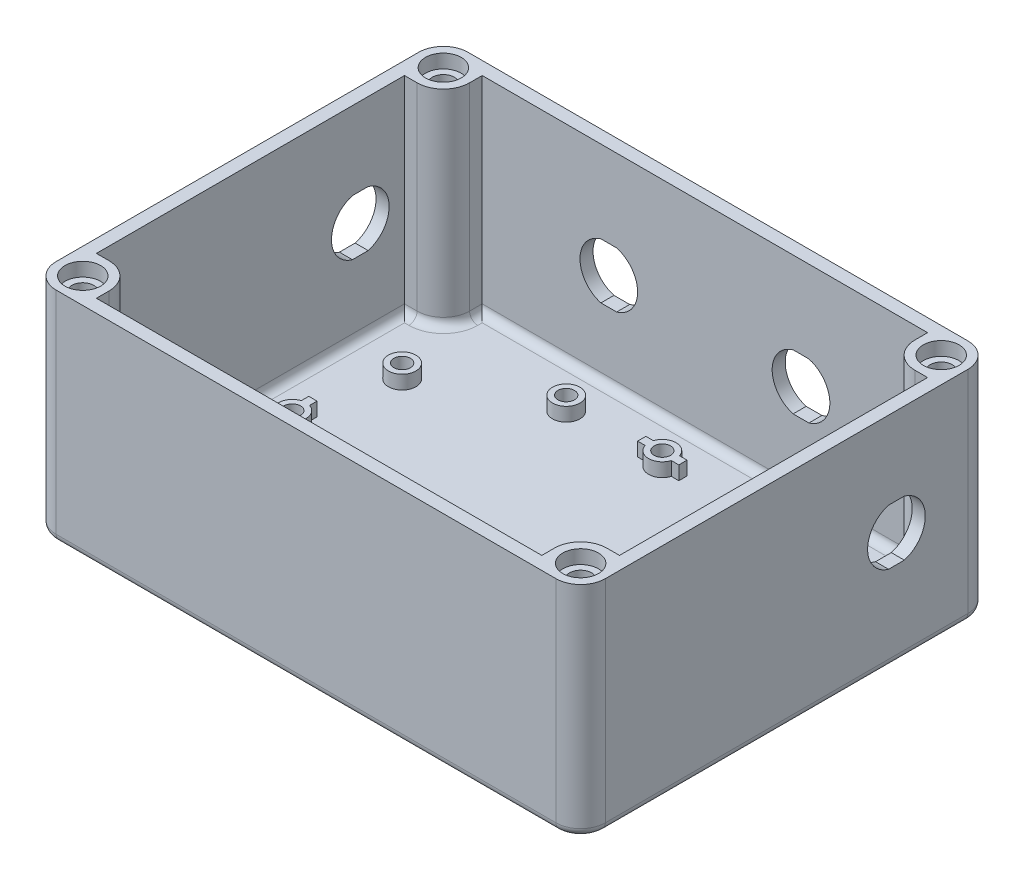
from build123d import *

# Parameters (mm, degrees)
SKETCH1_W           = 200
SKETCH1_H           = 150
BOSS_EXTRUDE1_DEPTH = 5
SKETCH2_W           = 200
SKETCH2_H           = 150
SKETCH2_W_2         = 190.5
SKETCH2_H_2         = 140.5
SKETCH2_R           = 4
BOSS_EXTRUDE2_DEPTH = 75
SKETCH3_R           = 6.5
CUT_EXTRUDE1_DEPTH  = 5
FILLET1_R           = 9
SKETCH4_R           = 5
SKETCH4_R_2         = 3
BOSS_EXTRUDE3_DEPTH = 5
FILLET2_R           = 3
FILLET3_R           = 3
CUT_EXTRUDE2_DEPTH  = 263.488094968
CUT_EXTRUDE3_DEPTH  = 10


with BuildPart() as part:
    # Sketch1 → Boss-Extrude1 (new body)
    with BuildSketch(Plane(origin=(0, 0, 0), x_dir=(1, 0, 0), z_dir=(0, 1, 0))):
        with Locations((100, 75)):
            Rectangle(SKETCH1_W, SKETCH1_H)
    extrude(amount=BOSS_EXTRUDE1_DEPTH)

    # Sketch2 → Boss-Extrude2 (add)
    # profile 1 of 5: a face of its own
    with BuildSketch(Plane(origin=(0, 5, 0), x_dir=(1, 0, 0), z_dir=(0, 1, 0))):
        with Locations((100, 75)):
            Rectangle(SKETCH2_W, SKETCH2_H)
        with Locations((100, 75)):
            Rectangle(SKETCH2_W_2, SKETCH2_H_2, mode=Mode.SUBTRACT)
    # profile 2 of 5: a face of its own
    with BuildSketch(Plane(origin=(0, 5, 0), x_dir=(1, 0, 0), z_dir=(0, 1, 0))):
        with BuildLine():
            Line((4.75, 145.25), (4.75, 131.1))
            Line((4.75, 131.1), (9.346194078, 131.1))
            ThreePointArc((9.346194078, 131.1), (16.101755032, 133.898244968), (18.9, 140.653805922))
            Line((18.9, 140.653805922), (18.9, 145.25))
            Line((18.9, 145.25), (4.75, 145.25))
        make_face()
        with Locations(Location((9.346194078, 140.653805922, 0), (0, 0, 90))):
            Circle(SKETCH2_R, mode=Mode.SUBTRACT)
    # profile 3 of 5: a face of its own
    with BuildSketch(Plane(origin=(0, 5, 0), x_dir=(1, 0, 0), z_dir=(0, 1, 0))):
        with BuildLine():
            Line((190.653805922, 131.1), (195.25, 131.1))
            Line((195.25, 131.1), (195.25, 145.25))
            Line((195.25, 145.25), (181.1, 145.25))
            Line((181.1, 145.25), (181.1, 140.653805922))
            ThreePointArc((181.1, 140.653805922), (183.898244968, 133.898244968), (190.653805922, 131.1))
        make_face()
        with Locations(Location((190.653805922, 140.653805922, 0), (0, 0, 270))):
            Circle(SKETCH2_R, mode=Mode.SUBTRACT)
    # profile 4 of 5: a face of its own
    with BuildSketch(Plane(origin=(0, 5, 0), x_dir=(1, 0, 0), z_dir=(0, 1, 0))):
        with BuildLine():
            Line((181.1, 9.346194078), (181.1, 4.75))
            Line((181.1, 4.75), (195.25, 4.75))
            Line((195.25, 4.75), (195.25, 18.9))
            Line((195.25, 18.9), (190.653805922, 18.9))
            ThreePointArc((190.653805922, 18.9), (183.898244968, 16.101755032), (181.1, 9.346194078))
        make_face()
        with Locations(Location((190.653805922, 9.346194078, 0), (0, 0, 90))):
            Circle(SKETCH2_R, mode=Mode.SUBTRACT)
    # profile 5 of 5: a face of its own
    with BuildSketch(Plane(origin=(0, 5, 0), x_dir=(1, 0, 0), z_dir=(0, 1, 0))):
        with BuildLine():
            Line((4.75, 18.9), (4.75, 4.75))
            Line((4.75, 4.75), (18.9, 4.75))
            Line((18.9, 4.75), (18.9, 9.346194078))
            ThreePointArc((18.9, 9.346194078), (16.101755032, 16.101755032), (9.346194078, 18.9))
            Line((9.346194078, 18.9), (4.75, 18.9))
        make_face()
        with Locations(Location((9.346194078, 9.346194078, 0), (0, 0, 270))):
            Circle(SKETCH2_R, mode=Mode.SUBTRACT)
    extrude(amount=BOSS_EXTRUDE2_DEPTH)

    # Sketch3 → Cut-Extrude1 (cut)
    with BuildSketch(Plane(origin=(0, 80, 0), x_dir=(1, 0, 0), z_dir=(0, 1, 0))):
        with Locations(Location((9.346194078, 140.653805922, 0), (0, 0, 270))):
            Circle(SKETCH3_R)
        with Locations(Location((190.653805922, 140.653805922, 0), (0, 0, 270))):
            Circle(SKETCH3_R)
        with Locations(Location((190.653805922, 9.346194078, 0), (0, 0, 270))):
            Circle(SKETCH3_R)
        with Locations(Location((9.346194078, 9.346194078, 0), (0, 0, 270))):
            Circle(SKETCH3_R)
    extrude(amount=-CUT_EXTRUDE1_DEPTH, mode=Mode.SUBTRACT)

    # Fillet1
    fillet1_edges = [part.edges().sort_by_distance(p)[0] for p in [
        (0, 40, -150),
        (200, 40, -150),
        (200, 40, 0),
        (0, 40, 0),
    ]]
    fillet(fillet1_edges, radius=FILLET1_R)

    # Sketch4 → Boss-Extrude3 (add)
    # profile 1 of 40: a face of its own
    with BuildSketch(Plane(origin=(0, 5, 0), x_dir=(1, 0, 0), z_dir=(0, 1, 0))):
        with Locations(Location((65, 129.75, 0), (0, 0, 90))):
            Circle(SKETCH4_R)
        with Locations(Location((65, 129.75, 0), (0, 0, 270))):
            Circle(SKETCH4_R_2, mode=Mode.SUBTRACT)
    # profile 2 of 40: a face of its own
    with BuildSketch(Plane(origin=(0, 5, 0), x_dir=(1, 0, 0), z_dir=(0, 1, 0))):
        with Locations(Location((25, 110, 0), (0, 0, 90))):
            Circle(SKETCH4_R)
        with Locations(Location((25, 110, 0), (0, 0, 270))):
            Circle(SKETCH4_R_2, mode=Mode.SUBTRACT)
    # profile 3 of 40: a face of its own
    with BuildSketch(Plane(origin=(0, 5, 0), x_dir=(1, 0, 0), z_dir=(0, 1, 0))):
        with BuildLine():
            Line((21.5, 82.5), (18.5, 82.5))
            Line((18.5, 82.5), (18.5, 79.769696007))
            ThreePointArc((18.5, 79.769696007), (20, 80), (21.5, 79.769696007))
            Line((21.5, 79.769696007), (21.5, 82.5))
        make_face()
    # profile 4 of 40: a face of its own
    with BuildSketch(Plane(origin=(0, 5, 0), x_dir=(1, 0, 0), z_dir=(0, 1, 0))):
        with BuildLine():
            ThreePointArc((21.5, 79.769696007), (20, 80), (18.5, 79.769696007))
            Line((18.5, 79.769696007), (18.5, 77.598076211))
            ThreePointArc((18.5, 77.598076211), (20, 78), (21.5, 77.598076211))
            Line((21.5, 77.598076211), (21.5, 79.769696007))
        make_face()
    # profile 5 of 40: a face of its own
    with BuildSketch(Plane(origin=(0, 5, 0), x_dir=(1, 0, 0), z_dir=(0, 1, 0))):
        with BuildLine():
            Line((18.5, 72.401923789), (18.5, 70.230303993))
            ThreePointArc((18.5, 70.230303993), (20, 70), (21.5, 70.230303993))
            Line((21.5, 70.230303993), (21.5, 72.401923789))
            ThreePointArc((21.5, 72.401923789), (20, 72), (18.5, 72.401923789))
        make_face()
    # profile 6 of 40: a face of its own
    with BuildSketch(Plane(origin=(0, 5, 0), x_dir=(1, 0, 0), z_dir=(0, 1, 0))):
        with BuildLine():
            Line((18.5, 77.598076211), (18.5, 79.769696007))
            ThreePointArc((18.5, 79.769696007), (15, 75), (18.5, 70.230303993))
            Line((18.5, 70.230303993), (18.5, 72.401923789))
            ThreePointArc((18.5, 72.401923789), (17, 75), (18.5, 77.598076211))
        make_face()
    # profile 7 of 40: a face of its own
    with BuildSketch(Plane(origin=(0, 5, 0), x_dir=(1, 0, 0), z_dir=(0, 1, 0))):
        with BuildLine():
            ThreePointArc((25, 75), (24.031128874, 77.958039892), (21.5, 79.769696007))
            Line((21.5, 79.769696007), (21.5, 77.598076211))
            ThreePointArc((21.5, 77.598076211), (22.598076211, 76.5), (23, 75))
            ThreePointArc((23, 75), (22.598076211, 73.5), (21.5, 72.401923789))
            Line((21.5, 72.401923789), (21.5, 70.230303993))
            ThreePointArc((21.5, 70.230303993), (24.031128874, 72.041960108), (25, 75))
        make_face()
    # profile 8 of 40: a face of its own
    with BuildSketch(Plane(origin=(0, 5, 0), x_dir=(1, 0, 0), z_dir=(0, 1, 0))):
        with BuildLine():
            ThreePointArc((21.5, 79.769696007), (20, 80), (18.5, 79.769696007))
            Line((18.5, 79.769696007), (18.5, 77.598076211))
            ThreePointArc((18.5, 77.598076211), (20, 78), (21.5, 77.598076211))
            Line((21.5, 77.598076211), (21.5, 79.769696007))
        make_face()
    # profile 9 of 40: a face of its own
    with BuildSketch(Plane(origin=(0, 5, 0), x_dir=(1, 0, 0), z_dir=(0, 1, 0))):
        with BuildLine():
            Line((18.5, 72.401923789), (18.5, 70.230303993))
            ThreePointArc((18.5, 70.230303993), (20, 70), (21.5, 70.230303993))
            Line((21.5, 70.230303993), (21.5, 72.401923789))
            ThreePointArc((21.5, 72.401923789), (20, 72), (18.5, 72.401923789))
        make_face()
    # profile 10 of 40: a face of its own
    with BuildSketch(Plane(origin=(0, 5, 0), x_dir=(1, 0, 0), z_dir=(0, 1, 0))):
        with BuildLine():
            ThreePointArc((21.5, 70.230303993), (20, 70), (18.5, 70.230303993))
            Line((18.5, 70.230303993), (18.5, 67.5))
            Line((18.5, 67.5), (21.5, 67.5))
            Line((21.5, 67.5), (21.5, 70.230303993))
        make_face()
    # profile 11 of 40: a face of its own
    with BuildSketch(Plane(origin=(0, 5, 0), x_dir=(1, 0, 0), z_dir=(0, 1, 0))):
        with Locations(Location((25, 40, 0), (0, 0, 90))):
            Circle(SKETCH4_R)
        with Locations(Location((25, 40, 0), (0, 0, 270))):
            Circle(SKETCH4_R_2, mode=Mode.SUBTRACT)
    # profile 12 of 40: a face of its own
    with BuildSketch(Plane(origin=(0, 5, 0), x_dir=(1, 0, 0), z_dir=(0, 1, 0))):
        with Locations(Location((65, 20.25, 0), (0, 0, 90))):
            Circle(SKETCH4_R)
        with Locations(Location((65, 20.25, 0), (0, 0, 270))):
            Circle(SKETCH4_R_2, mode=Mode.SUBTRACT)
    # profile 13 of 40: a face of its own
    with BuildSketch(Plane(origin=(0, 5, 0), x_dir=(1, 0, 0), z_dir=(0, 1, 0))):
        with BuildLine():
            ThreePointArc((104.769696007, 21.75), (100, 25.25), (95.230303993, 21.75))
            Line((95.230303993, 21.75), (97.401923789, 21.75))
            ThreePointArc((97.401923789, 21.75), (100, 23.25), (102.598076211, 21.75))
            Line((102.598076211, 21.75), (104.769696007, 21.75))
        make_face()
    # profile 14 of 40: a face of its own
    with BuildSketch(Plane(origin=(0, 5, 0), x_dir=(1, 0, 0), z_dir=(0, 1, 0))):
        with BuildLine():
            Line((97.401923789, 21.75), (95.230303993, 21.75))
            ThreePointArc((95.230303993, 21.75), (95, 20.25), (95.230303993, 18.75))
            Line((95.230303993, 18.75), (97.401923789, 18.75))
            ThreePointArc((97.401923789, 18.75), (97, 20.25), (97.401923789, 21.75))
        make_face()
    # profile 15 of 40: a face of its own
    with BuildSketch(Plane(origin=(0, 5, 0), x_dir=(1, 0, 0), z_dir=(0, 1, 0))):
        with BuildLine():
            ThreePointArc((105, 20.25), (104.942088629, 21.008788496), (104.769696007, 21.75))
            Line((104.769696007, 21.75), (102.598076211, 21.75))
            ThreePointArc((102.598076211, 21.75), (102.897777479, 21.026457135), (103, 20.25))
            ThreePointArc((103, 20.25), (102.897777479, 19.473542865), (102.598076211, 18.75))
            Line((102.598076211, 18.75), (104.769696007, 18.75))
            ThreePointArc((104.769696007, 18.75), (104.942088629, 19.491211504), (105, 20.25))
        make_face()
    # profile 16 of 40: a face of its own
    with BuildSketch(Plane(origin=(0, 5, 0), x_dir=(1, 0, 0), z_dir=(0, 1, 0))):
        with BuildLine():
            Line((95.230303993, 21.75), (92.5, 21.75))
            Line((92.5, 21.75), (92.5, 18.75))
            Line((92.5, 18.75), (95.230303993, 18.75))
            ThreePointArc((95.230303993, 18.75), (95, 20.25), (95.230303993, 21.75))
        make_face()
    # profile 17 of 40: a face of its own
    with BuildSketch(Plane(origin=(0, 5, 0), x_dir=(1, 0, 0), z_dir=(0, 1, 0))):
        with BuildLine():
            Line((97.401923789, 18.75), (95.230303993, 18.75))
            ThreePointArc((95.230303993, 18.75), (100, 15.25), (104.769696007, 18.75))
            Line((104.769696007, 18.75), (102.598076211, 18.75))
            ThreePointArc((102.598076211, 18.75), (100, 17.25), (97.401923789, 18.75))
        make_face()
    # profile 18 of 40: a face of its own
    with BuildSketch(Plane(origin=(0, 5, 0), x_dir=(1, 0, 0), z_dir=(0, 1, 0))):
        with BuildLine():
            Line((107.5, 21.75), (104.769696007, 21.75))
            ThreePointArc((104.769696007, 21.75), (104.942088629, 21.008788496), (105, 20.25))
            ThreePointArc((105, 20.25), (104.942088629, 19.491211504), (104.769696007, 18.75))
            Line((104.769696007, 18.75), (107.5, 18.75))
            Line((107.5, 18.75), (107.5, 21.75))
        make_face()
    # profile 19 of 40: a face of its own
    with BuildSketch(Plane(origin=(0, 5, 0), x_dir=(1, 0, 0), z_dir=(0, 1, 0))):
        with BuildLine():
            Line((97.401923789, 21.75), (95.230303993, 21.75))
            ThreePointArc((95.230303993, 21.75), (95, 20.25), (95.230303993, 18.75))
            Line((95.230303993, 18.75), (97.401923789, 18.75))
            ThreePointArc((97.401923789, 18.75), (97, 20.25), (97.401923789, 21.75))
        make_face()
    # profile 20 of 40: a face of its own
    with BuildSketch(Plane(origin=(0, 5, 0), x_dir=(1, 0, 0), z_dir=(0, 1, 0))):
        with BuildLine():
            ThreePointArc((105, 20.25), (104.942088629, 21.008788496), (104.769696007, 21.75))
            Line((104.769696007, 21.75), (102.598076211, 21.75))
            ThreePointArc((102.598076211, 21.75), (102.897777479, 21.026457135), (103, 20.25))
            ThreePointArc((103, 20.25), (102.897777479, 19.473542865), (102.598076211, 18.75))
            Line((102.598076211, 18.75), (104.769696007, 18.75))
            ThreePointArc((104.769696007, 18.75), (104.942088629, 19.491211504), (105, 20.25))
        make_face()
    # profile 21 of 40: a face of its own
    with BuildSketch(Plane(origin=(0, 5, 0), x_dir=(1, 0, 0), z_dir=(0, 1, 0))):
        with Locations(Location((135, 20.25, 0), (0, 0, 270))):
            Circle(SKETCH4_R)
        with Locations(Location((135, 20.25, 0), (0, 0, 90))):
            Circle(SKETCH4_R_2, mode=Mode.SUBTRACT)
    # profile 22 of 40: a face of its own
    with BuildSketch(Plane(origin=(0, 5, 0), x_dir=(1, 0, 0), z_dir=(0, 1, 0))):
        with Locations(Location((175, 40, 0), (0, 0, 270))):
            Circle(SKETCH4_R)
        with Locations(Location((175, 40, 0), (0, 0, 90))):
            Circle(SKETCH4_R_2, mode=Mode.SUBTRACT)
    # profile 23 of 40: a face of its own
    with BuildSketch(Plane(origin=(0, 5, 0), x_dir=(1, 0, 0), z_dir=(0, 1, 0))):
        with BuildLine():
            Line((178.5, 82.5), (178.5, 79.769696007))
            ThreePointArc((178.5, 79.769696007), (180, 80), (181.5, 79.769696007))
            Line((181.5, 79.769696007), (181.5, 82.5))
            Line((181.5, 82.5), (178.5, 82.5))
        make_face()
    # profile 24 of 40: a face of its own
    with BuildSketch(Plane(origin=(0, 5, 0), x_dir=(1, 0, 0), z_dir=(0, 1, 0))):
        with BuildLine():
            ThreePointArc((178.5, 79.769696007), (175, 75), (178.5, 70.230303993))
            Line((178.5, 70.230303993), (178.5, 72.401923789))
            ThreePointArc((178.5, 72.401923789), (177, 75), (178.5, 77.598076211))
            Line((178.5, 77.598076211), (178.5, 79.769696007))
        make_face()
    # profile 25 of 40: a face of its own
    with BuildSketch(Plane(origin=(0, 5, 0), x_dir=(1, 0, 0), z_dir=(0, 1, 0))):
        with BuildLine():
            ThreePointArc((178.5, 70.230303993), (180, 70), (181.5, 70.230303993))
            Line((181.5, 70.230303993), (181.5, 72.401923789))
            ThreePointArc((181.5, 72.401923789), (180, 72), (178.5, 72.401923789))
            Line((178.5, 72.401923789), (178.5, 70.230303993))
        make_face()
    # profile 26 of 40: a face of its own
    with BuildSketch(Plane(origin=(0, 5, 0), x_dir=(1, 0, 0), z_dir=(0, 1, 0))):
        with BuildLine():
            ThreePointArc((181.5, 79.769696007), (180, 80), (178.5, 79.769696007))
            Line((178.5, 79.769696007), (178.5, 77.598076211))
            ThreePointArc((178.5, 77.598076211), (180, 78), (181.5, 77.598076211))
            Line((181.5, 77.598076211), (181.5, 79.769696007))
        make_face()
    # profile 27 of 40: a face of its own
    with BuildSketch(Plane(origin=(0, 5, 0), x_dir=(1, 0, 0), z_dir=(0, 1, 0))):
        with BuildLine():
            Line((181.5, 72.401923789), (181.5, 70.230303993))
            ThreePointArc((181.5, 70.230303993), (184.031128874, 72.041960108), (185, 75))
            ThreePointArc((185, 75), (184.031128874, 77.958039892), (181.5, 79.769696007))
            Line((181.5, 79.769696007), (181.5, 77.598076211))
            ThreePointArc((181.5, 77.598076211), (182.598076211, 76.5), (183, 75))
            ThreePointArc((183, 75), (182.598076211, 73.5), (181.5, 72.401923789))
        make_face()
    # profile 28 of 40: a face of its own
    with BuildSketch(Plane(origin=(0, 5, 0), x_dir=(1, 0, 0), z_dir=(0, 1, 0))):
        with BuildLine():
            ThreePointArc((178.5, 70.230303993), (180, 70), (181.5, 70.230303993))
            Line((181.5, 70.230303993), (181.5, 72.401923789))
            ThreePointArc((181.5, 72.401923789), (180, 72), (178.5, 72.401923789))
            Line((178.5, 72.401923789), (178.5, 70.230303993))
        make_face()
    # profile 29 of 40: a face of its own
    with BuildSketch(Plane(origin=(0, 5, 0), x_dir=(1, 0, 0), z_dir=(0, 1, 0))):
        with BuildLine():
            ThreePointArc((181.5, 79.769696007), (180, 80), (178.5, 79.769696007))
            Line((178.5, 79.769696007), (178.5, 77.598076211))
            ThreePointArc((178.5, 77.598076211), (180, 78), (181.5, 77.598076211))
            Line((181.5, 77.598076211), (181.5, 79.769696007))
        make_face()
    # profile 30 of 40: a face of its own
    with BuildSketch(Plane(origin=(0, 5, 0), x_dir=(1, 0, 0), z_dir=(0, 1, 0))):
        with BuildLine():
            Line((178.5, 67.5), (181.5, 67.5))
            Line((181.5, 67.5), (181.5, 70.230303993))
            ThreePointArc((181.5, 70.230303993), (180, 70), (178.5, 70.230303993))
            Line((178.5, 70.230303993), (178.5, 67.5))
        make_face()
    # profile 31 of 40: a face of its own
    with BuildSketch(Plane(origin=(0, 5, 0), x_dir=(1, 0, 0), z_dir=(0, 1, 0))):
        with Locations(Location((175, 110, 0), (0, 0, 270))):
            Circle(SKETCH4_R)
        with Locations(Location((175, 110, 0), (0, 0, 90))):
            Circle(SKETCH4_R_2, mode=Mode.SUBTRACT)
    # profile 32 of 40: a face of its own
    with BuildSketch(Plane(origin=(0, 5, 0), x_dir=(1, 0, 0), z_dir=(0, 1, 0))):
        with Locations(Location((135, 129.75, 0), (0, 0, 270))):
            Circle(SKETCH4_R)
        with Locations(Location((135, 129.75, 0), (0, 0, 90))):
            Circle(SKETCH4_R_2, mode=Mode.SUBTRACT)
    # profile 33 of 40: a face of its own
    with BuildSketch(Plane(origin=(0, 5, 0), x_dir=(1, 0, 0), z_dir=(0, 1, 0))):
        with BuildLine():
            ThreePointArc((104.769696007, 131.25), (100, 134.75), (95.230303993, 131.25))
            Line((95.230303993, 131.25), (97.401923789, 131.25))
            ThreePointArc((97.401923789, 131.25), (100, 132.75), (102.598076211, 131.25))
            Line((102.598076211, 131.25), (104.769696007, 131.25))
        make_face()
    # profile 34 of 40: a face of its own
    with BuildSketch(Plane(origin=(0, 5, 0), x_dir=(1, 0, 0), z_dir=(0, 1, 0))):
        with BuildLine():
            Line((107.5, 131.25), (104.769696007, 131.25))
            ThreePointArc((104.769696007, 131.25), (104.942088629, 130.508788496), (105, 129.75))
            ThreePointArc((105, 129.75), (104.942088629, 128.991211504), (104.769696007, 128.25))
            Line((104.769696007, 128.25), (107.5, 128.25))
            Line((107.5, 128.25), (107.5, 131.25))
        make_face()
    # profile 35 of 40: a face of its own
    with BuildSketch(Plane(origin=(0, 5, 0), x_dir=(1, 0, 0), z_dir=(0, 1, 0))):
        with BuildLine():
            Line((97.401923789, 131.25), (95.230303993, 131.25))
            ThreePointArc((95.230303993, 131.25), (95, 129.75), (95.230303993, 128.25))
            Line((95.230303993, 128.25), (97.401923789, 128.25))
            ThreePointArc((97.401923789, 128.25), (97, 129.75), (97.401923789, 131.25))
        make_face()
    # profile 36 of 40: a face of its own
    with BuildSketch(Plane(origin=(0, 5, 0), x_dir=(1, 0, 0), z_dir=(0, 1, 0))):
        with BuildLine():
            ThreePointArc((105, 129.75), (104.942088629, 130.508788496), (104.769696007, 131.25))
            Line((104.769696007, 131.25), (102.598076211, 131.25))
            ThreePointArc((102.598076211, 131.25), (102.897777479, 130.526457135), (103, 129.75))
            ThreePointArc((103, 129.75), (102.897777479, 128.973542865), (102.598076211, 128.25))
            Line((102.598076211, 128.25), (104.769696007, 128.25))
            ThreePointArc((104.769696007, 128.25), (104.942088629, 128.991211504), (105, 129.75))
        make_face()
    # profile 37 of 40: a face of its own
    with BuildSketch(Plane(origin=(0, 5, 0), x_dir=(1, 0, 0), z_dir=(0, 1, 0))):
        with BuildLine():
            Line((97.401923789, 131.25), (95.230303993, 131.25))
            ThreePointArc((95.230303993, 131.25), (95, 129.75), (95.230303993, 128.25))
            Line((95.230303993, 128.25), (97.401923789, 128.25))
            ThreePointArc((97.401923789, 128.25), (97, 129.75), (97.401923789, 131.25))
        make_face()
    # profile 38 of 40: a face of its own
    with BuildSketch(Plane(origin=(0, 5, 0), x_dir=(1, 0, 0), z_dir=(0, 1, 0))):
        with BuildLine():
            ThreePointArc((105, 129.75), (104.942088629, 130.508788496), (104.769696007, 131.25))
            Line((104.769696007, 131.25), (102.598076211, 131.25))
            ThreePointArc((102.598076211, 131.25), (102.897777479, 130.526457135), (103, 129.75))
            ThreePointArc((103, 129.75), (102.897777479, 128.973542865), (102.598076211, 128.25))
            Line((102.598076211, 128.25), (104.769696007, 128.25))
            ThreePointArc((104.769696007, 128.25), (104.942088629, 128.991211504), (105, 129.75))
        make_face()
    # profile 39 of 40: a face of its own
    with BuildSketch(Plane(origin=(0, 5, 0), x_dir=(1, 0, 0), z_dir=(0, 1, 0))):
        with BuildLine():
            Line((95.230303993, 131.25), (92.5, 131.25))
            Line((92.5, 131.25), (92.5, 128.25))
            Line((92.5, 128.25), (95.230303993, 128.25))
            ThreePointArc((95.230303993, 128.25), (95, 129.75), (95.230303993, 131.25))
        make_face()
    # profile 40 of 40: a face of its own
    with BuildSketch(Plane(origin=(0, 5, 0), x_dir=(1, 0, 0), z_dir=(0, 1, 0))):
        with BuildLine():
            Line((97.401923789, 128.25), (95.230303993, 128.25))
            ThreePointArc((95.230303993, 128.25), (100, 124.75), (104.769696007, 128.25))
            Line((104.769696007, 128.25), (102.598076211, 128.25))
            ThreePointArc((102.598076211, 128.25), (100, 126.75), (97.401923789, 128.25))
        make_face()
    extrude(amount=BOSS_EXTRUDE3_DEPTH)

    # Fillet2
    fillet2_edges = [part.edges().sort_by_distance(p)[0] for p in [
        (192.951902961, 5, -18.9),
        (18.9, 5, -7.048097039),
        (16.101755032, 5, -16.101755032),
        (4.75, 5, -75),
        (7.048097039, 5, -131.1),
        (100, 5, -145.25),
        (181.1, 5, -142.951902961),
        (183.898244968, 5, -133.898244968),
        (195.25, 5, -75),
        (192.951902961, 5, -131.1),
        (18.9, 5, -142.951902961),
        (16.101755032, 5, -133.898244968),
        (7.048097039, 5, -18.9),
        (100, 5, -4.75),
        (181.1, 5, -7.048097039),
        (183.898244968, 5, -16.101755032),
    ]]
    fillet(fillet2_edges, radius=FILLET2_R)

    # Fillet3
    fillet3_edges = [part.edges().sort_by_distance(p)[0] for p in [
        (100, 0, -150),
        (0, 0, -75),
        (200, 0, -75),
        (100, 0, 0),
        (2.636038969, 0, -147.363961031),
        (2.636038969, 0, -2.636038969),
        (197.363961031, 0, -2.636038969),
        (197.363961031, 0, -147.363961031),
    ]]
    fillet(fillet3_edges, radius=FILLET3_R)

    # Sketch5 → Cut-Extrude2 (cut, through all)
    with BuildSketch(Plane.ZY):
        with BuildLine():
            Line((-117.870540019, 31.4), (-112.129459981, 31.4))
            ThreePointArc((-112.129459981, 31.4), (-104.5, 41.5), (-112.129459981, 51.6))
            Line((-112.129459981, 51.6), (-117.870540019, 51.6))
            ThreePointArc((-117.870540019, 51.6), (-125.5, 41.5), (-117.870540019, 31.4))
        make_face()
    extrude(amount=-CUT_EXTRUDE2_DEPTH, mode=Mode.SUBTRACT)

    # Sketch6 → Cut-Extrude3 (cut)
    with BuildSketch(Plane.XY.offset(-150)):
        with BuildLine():
            Line((62.129459981, 50.1), (67.870540019, 50.1))
            ThreePointArc((67.870540019, 50.1), (75.5, 40), (67.870540019, 29.9))
            Line((67.870540019, 29.9), (62.129459981, 29.9))
            ThreePointArc((62.129459981, 29.9), (54.5, 40), (62.129459981, 50.1))
        make_face()
        with BuildLine():
            Line((137.870540019, 29.9), (132.129459981, 29.9))
            ThreePointArc((132.129459981, 29.9), (124.5, 40), (132.129459981, 50.1))
            Line((132.129459981, 50.1), (137.870540019, 50.1))
            ThreePointArc((137.870540019, 50.1), (145.5, 40), (137.870540019, 29.9))
        make_face()
    extrude(amount=CUT_EXTRUDE3_DEPTH, mode=Mode.SUBTRACT)


solid = part.part
